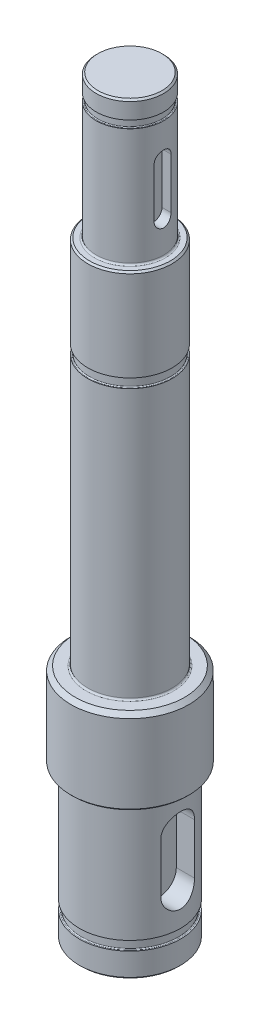
from build123d import *

# Parameters (mm, degrees)
CHAMFER1_SIZE      = 0.5
CHAMFER2_SIZE      = 0.2
FILLET1_R          = 0.2
CUT_EXTRUDE1_DEPTH = 90.890210813
CUT_EXTRUDE2_DEPTH = 90.811135167


with BuildPart() as part:
    # Sketch1 → Revolve1 (revolve)
    with BuildSketch(Plane(origin=(0, 0, 0), x_dir=(0, 0, -1), z_dir=(1, 0, 0)), mode=Mode.PRIVATE) as revolve1_sk:
        Polygon((0, 0), (0, -89), (6, -89), (6, -71), (7, -71), (7, -61), (5, -61), (5, -17), (4, -17), (4, 0), align=None)
    revolve(revolve1_sk.sketch.rotate(Axis((0, 27.897765143, 0), (0, -1, 0)), 180), axis=Axis((0, 27.897765143, 0), (0, -1, 0)))

    # Sketch9 → Groove for BS 3673 P4 - S012M_ External (revolve, cut)
    with BuildSketch(Plane(origin=(0, 27.897765143, 0), x_dir=(0, 0, 1), z_dir=(-1, 0, 0))):
        with BuildLine():
            Line((5.86, -113.997765143), (7.2, -113.997765143))
            Line((7.2, -113.997765143), (7.2, -112.897765143))
            Line((7.2, -112.897765143), (5.86, -112.897765143))
            ThreePointArc((5.86, -112.897765143), (5.782218254, -112.929983397), (5.75, -113.007765143))
            Line((5.75, -113.007765143), (5.75, -113.887765143))
            ThreePointArc((5.75, -113.887765143), (5.782218254, -113.965546889), (5.86, -113.997765143))
        make_face()
    revolve(axis=Axis((0, -22.102234857, 0), (0, 1, 0)), mode=Mode.SUBTRACT)

    # Sketch11 → Groove for BS 3673 P4 - S010M_ External (revolve, cut)
    with BuildSketch(Plane(origin=(0, 27.897765143, 0), x_dir=(0, 0, 1), z_dir=(-1, 0, 0))):
        with BuildLine():
            Line((4.91, -56.897765143), (6, -56.897765143))
            Line((6, -56.897765143), (6, -55.797765143))
            Line((6, -55.797765143), (4.91, -55.797765143))
            ThreePointArc((4.91, -55.797765143), (4.832218254, -55.829983397), (4.8, -55.907765143))
            Line((4.8, -55.907765143), (4.8, -56.787765143))
            ThreePointArc((4.8, -56.787765143), (4.832218254, -56.865546889), (4.91, -56.897765143))
        make_face()
    revolve(axis=Axis((0, -22.102234857, 0), (0, 1, 0)), mode=Mode.SUBTRACT)

    # Sketch13 → Groove for BS 3673 P4 - S008M, External Circlip1 (revolve, cut)
    with BuildSketch(Plane(origin=(0, 27.897765143, 0), x_dir=(0, 0, 1), z_dir=(-1, 0, 0))):
        with BuildLine():
            Line((3.89, -30.897765143), (4.8, -30.897765143))
            Line((4.8, -30.897765143), (4.8, -29.997765143))
            Line((4.8, -29.997765143), (3.89, -29.997765143))
            ThreePointArc((3.89, -29.997765143), (3.82636039, -30.024125532), (3.8, -30.087765143))
            Line((3.8, -30.087765143), (3.8, -30.807765143))
            ThreePointArc((3.8, -30.807765143), (3.82636039, -30.871404753), (3.89, -30.897765143))
        make_face()
    revolve(axis=Axis((0, -22.102234857, 0), (0, 1, 0)), mode=Mode.SUBTRACT)

    # Chamfer1
    chamfer1_edges = [part.edges().sort_by_distance(p)[0] for p in [
        (0, -61, -7),
    ]]
    chamfer(chamfer1_edges, length=CHAMFER1_SIZE)

    # Chamfer2
    chamfer2_edges = [part.edges().sort_by_distance(p)[0] for p in [
        (0, -71, -7),
        (0, -89, -6),
        (0, 0, -4),
        (0, -17, -5),
    ]]
    chamfer(chamfer2_edges, length=CHAMFER2_SIZE)

    # Fillet1
    fillet1_edges = [part.edges().sort_by_distance(p)[0] for p in [
        (0, -71, -6),
        (0, -17, -4),
        (0, -61, -5),
    ]]
    fillet(fillet1_edges, radius=FILLET1_R)

    # Sketch14 → Cut-Extrude1 (cut, through all)
    with BuildSketch(Plane(origin=(3.5, 0, 0), x_dir=(0, 0, -1), z_dir=(1, 0, 0))):
        with BuildLine():
            Line((-2, -81), (-2, -75))
            ThreePointArc((-2, -75), (0, -73), (2, -75))
            Line((2, -75), (2, -81))
            ThreePointArc((2, -81), (0, -83), (-2, -81))
        make_face()
    extrude(amount=CUT_EXTRUDE1_DEPTH, mode=Mode.SUBTRACT)

    # Sketch15 → Cut-Extrude2 (cut, through all)
    with BuildSketch(Plane(origin=(2.8, 0, 0), x_dir=(0, 0, -1), z_dir=(1, 0, 0))):
        with BuildLine():
            Line((-1, -13), (-1, -7))
            ThreePointArc((-1, -7), (0, -6), (1, -7))
            Line((1, -7), (1, -13))
            ThreePointArc((1, -13), (0, -14), (-1, -13))
        make_face()
    extrude(amount=CUT_EXTRUDE2_DEPTH, mode=Mode.SUBTRACT)


solid = part.part
